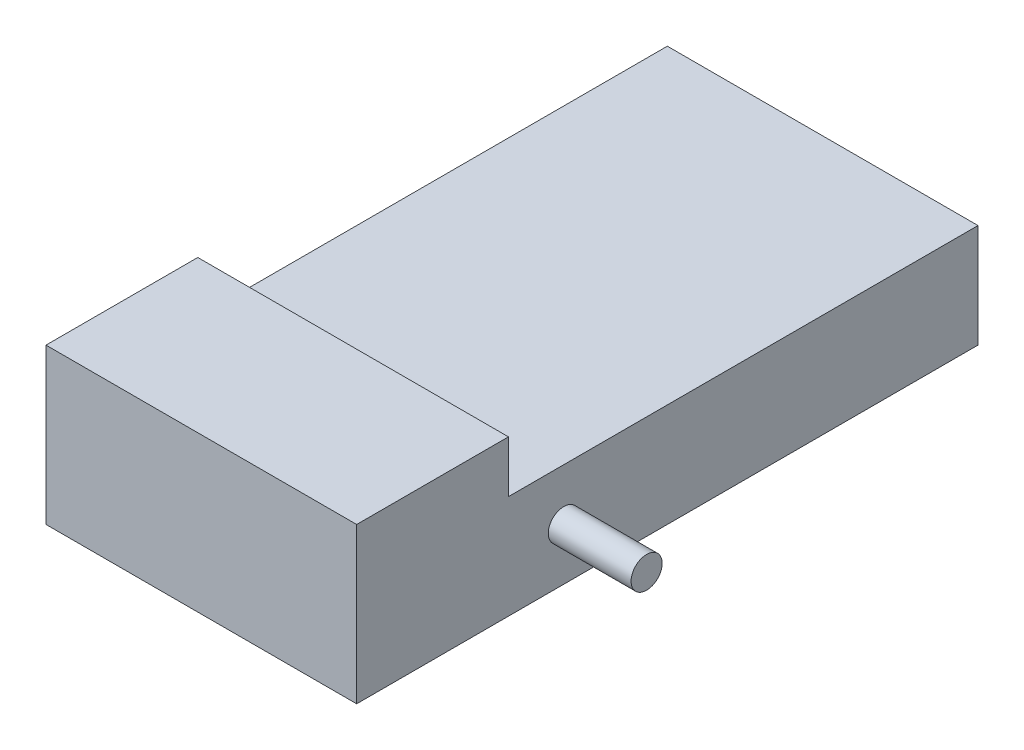
from build123d import *

# Parameters (mm, degrees)
SKETCH2_W           = 38.1
SKETCH2_H           = 76.2
BOSS_EXTRUDE1_DEPTH = 12.7
SKETCH5_W           = 38.1
SKETCH5_H           = 18.614666354
BOSS_EXTRUDE5_DEPTH = 2.54
SKETCH4_R           = 1.905
BOSS_EXTRUDE6_DEPTH = 10.16
SKETCH7_W           = 38.1
SKETCH7_H           = 18.614666354
BOSS_EXTRUDE7_DEPTH = 3.81


with BuildPart() as part:
    # Sketch2 → Boss-Extrude1 (new body)
    with BuildSketch(Plane(origin=(0, 0, 0), x_dir=(1, 0, 0), z_dir=(0, 1, 0))):
        with Locations((19.05, 38.1)):
            Rectangle(SKETCH2_W, SKETCH2_H)
    extrude(amount=BOSS_EXTRUDE1_DEPTH)

    # Sketch5 → Boss-Extrude5 (add)
    with BuildSketch(Plane(origin=(0, 12.7, 0), x_dir=(1, 0, 0), z_dir=(0, 1, 0))):
        with Locations((19.05, 9.307333177)):
            Rectangle(SKETCH5_W, SKETCH5_H)
    extrude(amount=BOSS_EXTRUDE5_DEPTH)

    # Sketch4 → Boss-Extrude6 (add)
    with BuildSketch(Plane(origin=(38.1, 0, 0), x_dir=(0, 0, -1), z_dir=(1, 0, 0))):
        with Locations(Location((25.4, 6.35, 0), (0, 0, 180))):
            Circle(SKETCH4_R)
    extrude(amount=BOSS_EXTRUDE6_DEPTH)

    # Sketch7 → Boss-Extrude7 (add)
    with BuildSketch(Plane(origin=(0, 15.24, 0), x_dir=(1, 0, 0), z_dir=(0, 1, 0))):
        with Locations((19.05, 9.307333177)):
            Rectangle(SKETCH7_W, SKETCH7_H)
    extrude(amount=BOSS_EXTRUDE7_DEPTH)


solid = part.part
